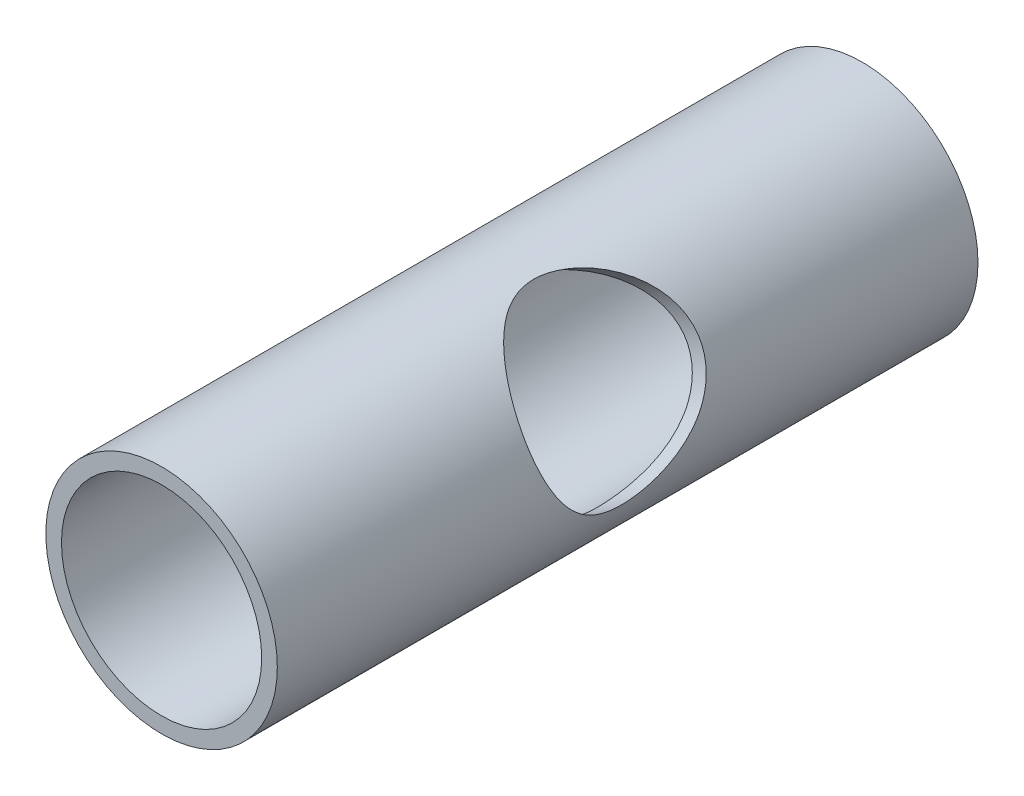
from build123d import *

# Parameters (mm, degrees)
SKETCH1_R           = 185
SKETCH1_R_2         = 160
BOSS_EXTRUDE1_DEPTH = 1120
SKETCH4_R           = 140
CUT_EXTRUDE1_DEPTH  = 200


with BuildPart() as part:
    # Sketch1 → Boss-Extrude1 (new body)
    with BuildSketch(Plane.XY):
        Circle(SKETCH1_R)
        Circle(SKETCH1_R_2, mode=Mode.SUBTRACT)
    extrude(amount=BOSS_EXTRUDE1_DEPTH)

    # Sketch4 → Cut-Extrude1 (cut)
    with BuildSketch(Plane(origin=(160.2146997, 92.5, 1120), x_dir=(0, 0, -1), z_dir=(0.8660254037844397, 0.49999999999999806, 0))):
        with Locations(Location((560, 0, 0), (0, 0, 90))):
            Circle(SKETCH4_R)
    extrude(amount=-CUT_EXTRUDE1_DEPTH, mode=Mode.SUBTRACT)


solid = part.part
